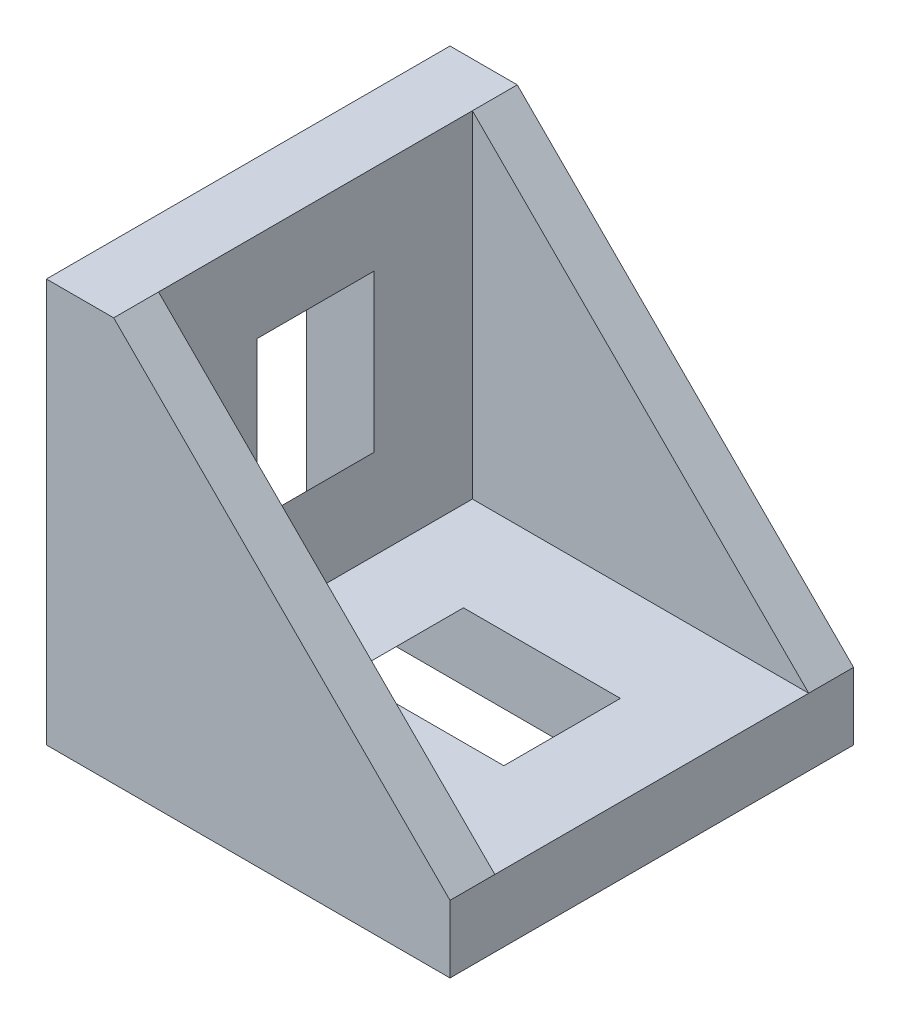
from build123d import *

# Parameters (mm, degrees)
BOSS_EXTRUDE1_DEPTH = 9
CUT_EXTRUDE1_DEPTH  = 7
CUT_EXTRUDE2_DEPTH  = 2.6
BOSS_EXTRUDE2_DEPTH = 3


with BuildPart() as part:
    # Sketch1 → Boss-Extrude1 (new, symmetric)
    with BuildSketch(Plane.XY):
        Polygon((0, 0), (0, 18), (3, 18), (18, 3), (18, 0), align=None)
    extrude(amount=BOSS_EXTRUDE1_DEPTH, both=True)

    # Sketch2 → Cut-Extrude1 (cut, symmetric)
    with BuildSketch(Plane.XY):
        Polygon((3, 18), (3, 3), (18, 3), align=None)
    extrude(amount=CUT_EXTRUDE1_DEPTH, both=True, mode=Mode.SUBTRACT)

    # Sketch3 → Cut-Extrude2 (cut, symmetric)
    with BuildSketch(Plane.XY):
        Polygon((0, 14), (3, 14), (3, 7), (0, 4), align=None)
        Polygon((7, 3), (14, 3), (14, 0), (4, 0), align=None)
    extrude(amount=CUT_EXTRUDE2_DEPTH, both=True, mode=Mode.SUBTRACT)

    # Sketch4 → Boss-Extrude2 (add, symmetric)
    with BuildSketch(Plane.XY):
        Polygon((1.497483368, -1.80628538), (0.504853677, -0.797938337), (1.234750477, 0), (3.535533906, 0), align=None)
        Polygon((0, 3.535533906), (-1.80628538, 1.497483368), (-0.797938337, 0.504853677), (0, 1.234750477), align=None)
        Polygon((0, 17.3), (0, 14.999216572), (-0.797938337, 14.269319771), (-1.80628538, 15.261949462), align=None)
        Polygon((14.999216572, 0), (14.269319771, -0.797938337), (15.261949462, -1.80628538), (17.3, 0), align=None)
    extrude(amount=BOSS_EXTRUDE2_DEPTH, both=True)


solid = part.part
